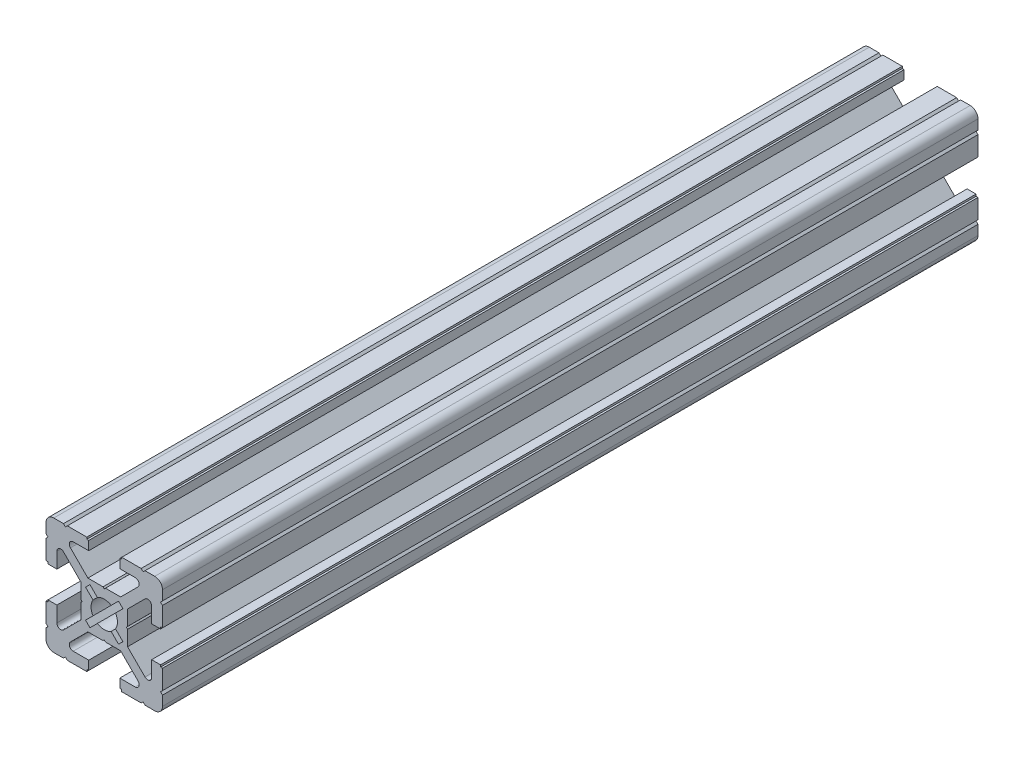
from build123d import *

# Parameters (mm, degrees)
BOSS_EXTRUDE1_DEPTH = 210


with BuildPart() as part:
    # Sketch1 → Boss-Extrude1 (new body)
    with BuildSketch(Plane.XY):
        with BuildLine():
            Line((12.999999999, 14.999999999), (10.499999999, 14.999999999))
            Line((10.499999999, 14.999999999), (9.999999999, 14.499999999))
            Line((9.999999999, 14.499999999), (9.5, 14.999999999))
            Line((9.5, 14.999999999), (4.5, 14.999999999))
            Line((4.5, 14.999999999), (4.5, 14.5))
            Line((4.5, 14.5), (4, 14.5))
            Line((4, 14.5), (4, 12.200000005))
            Line((4, 12.200000005), (7.999999994, 12.200000005))
            ThreePointArc((7.999999994, 12.200000005), (8.923879532, 11.582683434), (8.707106779, 10.492893215))
            Line((8.707106779, 10.492893215), (4.214213564, 6))
            Line((4.214213564, 6), (0.312520901, 6))
            Line((0.312520901, 6), (0, 5.7))
            Line((0, 5.7), (-0.312520903, 6))
            Line((-0.312520903, 6), (-4.214213564, 6))
            Line((-4.214213564, 6), (-8.70710678, 10.492893215))
            ThreePointArc((-8.70710678, 10.492893215), (-8.923879532, 11.582683434), (-7.999999995, 12.200000005))
            Line((-7.999999995, 12.200000005), (-4, 12.200000005))
            Line((-4, 12.200000005), (-4, 14.5))
            Line((-4, 14.5), (-4.5, 14.5))
            Line((-4.5, 14.5), (-4.5, 14.999999999))
            Line((-4.5, 14.999999999), (-9.500000003, 14.999999999))
            Line((-9.500000003, 14.999999999), (-10.000000002, 14.499999999))
            Line((-10.000000002, 14.499999999), (-10.500000001, 14.999999999))
            Line((-10.500000001, 14.999999999), (-13, 14.999999999))
            ThreePointArc((-13, 14.999999999), (-14.414213562, 14.414213561), (-15, 12.999999999))
            Line((-15, 12.999999999), (-15, 10.5))
            Line((-15, 10.5), (-14.500000001, 10.000000001))
            Line((-14.500000001, 10.000000001), (-15, 9.500000001))
            Line((-15, 9.500000001), (-15, 4.5))
            Line((-15, 4.5), (-14.5, 4.5))
            Line((-14.5, 4.5), (-14.5, 4))
            Line((-14.5, 4), (-12.200000005, 4))
            Line((-12.200000005, 4), (-12.200000005, 7.999999994))
            ThreePointArc((-12.200000005, 7.999999994), (-11.582683434, 8.923879532), (-10.492893215, 8.707106779))
            Line((-10.492893215, 8.707106779), (-6, 4.214213564))
            Line((-6, 4.214213564), (-6, 0.312520901))
            Line((-6, 0.312520901), (-5.7, 0))
            Line((-5.7, 0), (-6, -0.312520903))
            Line((-6, -0.312520903), (-6, -4.214213564))
            Line((-6, -4.214213564), (-10.492893215, -8.70710678))
            ThreePointArc((-10.492893215, -8.70710678), (-11.582683434, -8.923879532), (-12.200000005, -7.999999995))
            Line((-12.200000005, -7.999999995), (-12.200000005, -4))
            Line((-12.200000005, -4), (-14.5, -4))
            Line((-14.5, -4), (-14.5, -4.5))
            Line((-14.5, -4.5), (-15, -4.5))
            Line((-15, -4.5), (-15, -9.500000001))
            Line((-15, -9.500000001), (-14.500000001, -10.000000001))
            Line((-14.500000001, -10.000000001), (-15, -10.5))
            Line((-15, -10.5), (-15, -13))
            ThreePointArc((-15, -13), (-14.414213562, -14.414213562), (-13, -15))
            Line((-13, -15), (-10.489897949, -15))
            Line((-10.489897949, -15), (-9.989897949, -14.5))
            Line((-9.989897949, -14.5), (-9.500000001, -15))
            Line((-9.500000001, -15), (-4.5, -15))
            Line((-4.5, -15), (-4.5, -14.5))
            Line((-4.5, -14.5), (-4, -14.5))
            Line((-4, -14.5), (-4, -12.200000005))
            Line((-4, -12.200000005), (-7.999999995, -12.200000005))
            ThreePointArc((-7.999999995, -12.200000005), (-8.923879532, -11.582683434), (-8.70710678, -10.492893215))
            Line((-8.70710678, -10.492893215), (-4.214213564, -6))
            Line((-4.214213564, -6), (-0.312520901, -6))
            Line((-0.312520901, -6), (0, -5.7))
            Line((0, -5.7), (0.312520903, -6))
            Line((0.312520903, -6), (4.214213564, -6))
            Line((4.214213564, -6), (8.70710678, -10.492893215))
            ThreePointArc((8.70710678, -10.492893215), (8.923879532, -11.582683434), (7.999999995, -12.200000005))
            Line((7.999999995, -12.200000005), (4, -12.200000005))
            Line((4, -12.200000005), (4, -14.5))
            Line((4, -14.5), (4.5, -14.5))
            Line((4.5, -14.5), (4.5, -15))
            Line((4.5, -15), (9.500000001, -15))
            Line((9.500000001, -15), (10.000000001, -14.500000001))
            Line((10.000000001, -14.500000001), (10.5, -15))
            Line((10.5, -15), (12.999999999, -15))
            ThreePointArc((12.999999999, -15), (14.414213561, -14.414213562), (14.999999999, -13))
            Line((14.999999999, -13), (14.999999999, -10.500000001))
            Line((14.999999999, -10.500000001), (14.499999999, -10.000000002))
            Line((14.499999999, -10.000000002), (14.999999999, -9.500000002))
            Line((14.999999999, -9.500000002), (14.999999999, -4.5))
            Line((14.999999999, -4.5), (14.5, -4.5))
            Line((14.5, -4.5), (14.5, -4))
            Line((14.5, -4), (12.200000005, -4))
            Line((12.200000005, -4), (12.200000005, -7.999999995))
            ThreePointArc((12.200000005, -7.999999995), (11.582683434, -8.923879532), (10.492893215, -8.70710678))
            Line((10.492893215, -8.70710678), (6, -4.214213564))
            Line((6, -4.214213564), (6, -0.312520901))
            Line((6, -0.312520901), (5.7, 0))
            Line((5.7, 0), (6, 0.312520903))
            Line((6, 0.312520903), (6, 4.214213564))
            Line((6, 4.214213564), (10.492893215, 8.70710678))
            ThreePointArc((10.492893215, 8.70710678), (11.582683434, 8.923879532), (12.200000005, 7.999999995))
            Line((12.200000005, 7.999999995), (12.200000005, 4))
            Line((12.200000005, 4), (14.5, 4))
            Line((14.5, 4), (14.5, 4.5))
            Line((14.5, 4.5), (14.999999999, 4.5))
            Line((14.999999999, 4.5), (14.999999999, 9.5))
            Line((14.999999999, 9.5), (14.499999999, 9.999999999))
            Line((14.499999999, 9.999999999), (14.999999999, 10.499999999))
            Line((14.999999999, 10.499999999), (14.999999999, 12.999999999))
            ThreePointArc((14.999999999, 12.999999999), (14.414213561, 14.414213561), (12.999999999, 14.999999999))
        make_face()
        with BuildLine():
            Line((-2.902349714, 1.770978864), (-4.808326112, 3.676955262))
            Line((-4.808326112, 3.676955262), (-3.676955262, 4.808326112))
            Line((-3.676955262, 4.808326112), (-1.770978864, 2.902349714))
            ThreePointArc((-1.770978864, 2.902349714), (0, 3.4), (1.770978864, 2.902349714))
            Line((1.770978864, 2.902349714), (3.676955262, 4.808326112))
            Line((3.676955262, 4.808326112), (4.808326112, 3.676955262))
            Line((4.808326112, 3.676955262), (2.902349714, 1.770978864))
            ThreePointArc((2.902349714, 1.770978864), (3.4, 0), (2.902349714, -1.770978864))
            Line((2.902349714, -1.770978864), (4.808326112, -3.676955262))
            Line((4.808326112, -3.676955262), (3.676955262, -4.808326112))
            Line((3.676955262, -4.808326112), (1.770978864, -2.902349714))
            ThreePointArc((1.770978864, -2.902349714), (0, -3.4), (-1.770978864, -2.902349714))
            Line((-1.770978864, -2.902349714), (-3.676955262, -4.808326112))
            Line((-3.676955262, -4.808326112), (-4.808326112, -3.676955262))
            Line((-4.808326112, -3.676955262), (-2.902349714, -1.770978864))
            ThreePointArc((-2.902349714, -1.770978864), (-3.4, 0), (-2.902349714, 1.770978864))
        make_face(mode=Mode.SUBTRACT)
    extrude(amount=BOSS_EXTRUDE1_DEPTH)


solid = part.part
